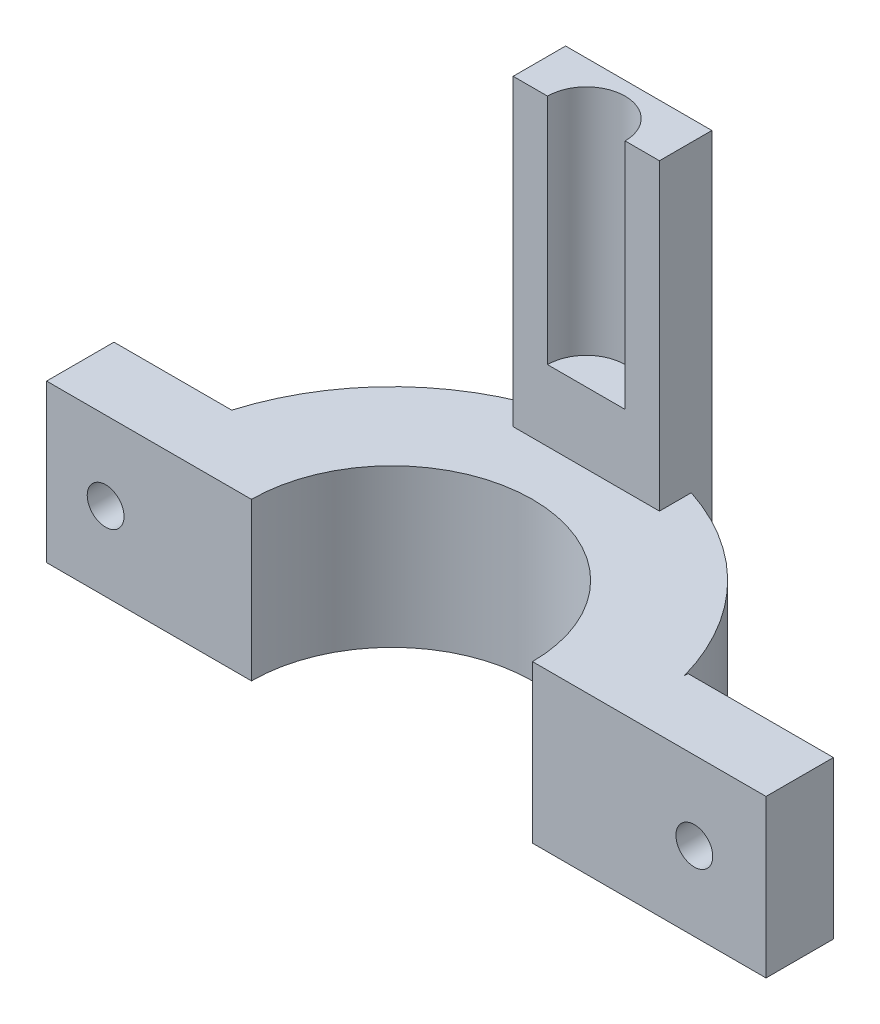
from build123d import *

# Parameters (mm, degrees)
SKETCH_1_W                = 48.51
SKETCH_1_H                = 34
SKETCH_1_W_2              = 28.51
SKETCH_1_H_2              = 14
EXTRUDE_1_DEPTH           = 12.25
SKETCH_2_R                = 1.91
CUT_EXTRUDE_1_DEPTH       = 33.05257439
SKETCH_4_W                = 13
SKETCH_4_H                = 13.91
EXTRUDE_1_2_DEPTH         = 74.82
SKETCH_5_W                = 13.91
SKETCH_5_H                = 16.23
EXTRUDE_2_DEPTH           = 15
SKETCH_7_R                = 24.5
SKETCH_7_R_2              = 14.5
EXTRUDE_2_2_DEPTH         = 16.23
SKETCH_12_R               = 1.9
CUT_EXTRUDE_4_DEPTH       = 97.312124675
EXTRUDE_3_DEPTH           = 10
EXTRUDE_3_DEPTH_BACK      = 8
SKETCH_13_W               = 13.91
SKETCH_13_H               = 16.23
SKETCH_14_R               = 1.9
CUT_EXTRUDE_5_DEPTH       = 103.744583434
SKETCH_16_W               = 90.709398763
SKETCH_16_H               = 28.955068616
CUT_EXTRUDE_7_DEPTH       = 111.229011154
SKETCH_18_W               = 13
SKETCH_18_H               = 93.080932143
CUT_EXTRUDE_10_DEPTH      = 27
CUT_EXTRUDE_11_DEPTH      = 57
CUT_EXTRUDE_11_DEPTH_BACK = 27
SKETCH_17_W               = 20.23049449
SKETCH_17_H               = 80.723570055
SKETCH_21_W               = 15.09856282
SKETCH_21_H               = 42.5
EXTRUDE_6_DEPTH           = 10
SKETCH_22_R               = 4.005
CUT_EXTRUDE_12_DEPTH      = 24
SKETCH_23_W               = 15.09856282
SKETCH_23_H               = 4.587452919
CUT_EXTRUDE_13_DEPTH      = 85.439664289


with BuildPart() as part:
    # 草圖1 → Extrude 1 (new body)
    with BuildSketch(Plane(origin=(0, 0, 0), x_dir=(1, 0, 0), z_dir=(0, 1, 0))):
        Rectangle(SKETCH_1_W, SKETCH_1_H)
        Rectangle(SKETCH_1_W_2, SKETCH_1_H_2, mode=Mode.SUBTRACT)
    extrude(amount=EXTRUDE_1_DEPTH)

    # 草圖2 → 除料-伸長1 (cut, through all)
    with BuildSketch(Plane(origin=(0, 12.25, 0), x_dir=(1, 0, 0), z_dir=(0, 1, 0))):
        with Locations(Location((-19.255, 0, 0), (0, 0, 270))):
            Circle(SKETCH_2_R)
        with Locations(Location((19.255, 0, 0), (0, 0, 270))):
            Circle(SKETCH_2_R)
    extrude(amount=-CUT_EXTRUDE_1_DEPTH, mode=Mode.SUBTRACT)

    # 草圖4 → Extrude 1 2 (add)
    with BuildSketch(Plane.XZ):
        with Locations((17.755, 0)):
            Rectangle(SKETCH_4_W, SKETCH_4_H)
    extrude(amount=EXTRUDE_1_2_DEPTH)

    # 草圖5 → Extrude 2 (add)
    with BuildSketch(Plane.ZY.offset(-11.255)):
        with Locations((0, -66.705)):
            Rectangle(SKETCH_5_W, SKETCH_5_H)
    extrude(amount=EXTRUDE_2_DEPTH)

    # 草圖7 → Extrude 2 2 (add)
    with BuildSketch(Plane(origin=(3.626674765, -74.82, 0), x_dir=(1, 0, 0), z_dir=(0, -1, 0))):
        with Locations((-30.978154344, 0)):
            Circle(SKETCH_7_R)
        with Locations((-30.978154344, 0)):
            Circle(SKETCH_7_R_2, mode=Mode.SUBTRACT)
    extrude(amount=-EXTRUDE_2_2_DEPTH)

    # 草圖12 → 除料-伸長4 (cut, through all)
    with BuildSketch(Plane(origin=(0, 0, -6.955), x_dir=(-1, 0, 0), z_dir=(0, 0, -1))):
        with Locations((-3.856713649, -66.705)):
            Circle(SKETCH_12_R)
    extrude(amount=-CUT_EXTRUDE_4_DEPTH, mode=Mode.SUBTRACT)

    # 草圖13 → 填料-伸長3 (add, two sides: drawn at the far end of the back side and taken through both)
    with BuildSketch(Plane(origin=(-55, 0, 0), x_dir=(0, 0, -1), z_dir=(1, 0, 0)).offset(-EXTRUDE_3_DEPTH_BACK)):
        with Locations((0, -66.705)):
            Rectangle(SKETCH_13_W, SKETCH_13_H)
    extrude(amount=EXTRUDE_3_DEPTH + EXTRUDE_3_DEPTH_BACK)

    # 草圖14 → 除料-伸長5 (cut, through all)
    with BuildSketch(Plane(origin=(0, 0, -6.955), x_dir=(-1, 0, 0), z_dir=(0, 0, -1))):
        with Locations((56.908040017, -66.705)):
            Circle(SKETCH_14_R)
    extrude(amount=-CUT_EXTRUDE_5_DEPTH, mode=Mode.SUBTRACT)

    # 草圖16 → 除料-伸長7 (cut, through all)
    with BuildSketch(Plane(origin=(0, 12.25, 0), x_dir=(1, 0, 0), z_dir=(0, 1, 0))):
        with Locations((-17.645300619, -14.477534308)):
            Rectangle(SKETCH_16_W, SKETCH_16_H)
    extrude(amount=-CUT_EXTRUDE_7_DEPTH, mode=Mode.SUBTRACT)

    # 草圖18 → 除料-伸長10 (cut)
    with BuildSketch(Plane.XY):
        with Locations((17.755, -28.279533929)):
            Rectangle(SKETCH_18_W, SKETCH_18_H)
    extrude(amount=-CUT_EXTRUDE_10_DEPTH, mode=Mode.SUBTRACT)


with BuildPart() as cut_extrude_10_piece_1:
    # of the separate pieces the step leaves, piece 1, a body of its own (cut_extrude_10_pieces)
    add(part.part.solids().sort_by_distance((11.255, -58.59, -6.955))[0])

    # 草圖21 → 填料-伸長6 (add)
    with BuildSketch(Plane.XY.offset(-30)):
        with Locations((-27.29428141, -48.519427919)):
            Rectangle(SKETCH_21_W, SKETCH_21_H)
    extrude(amount=EXTRUDE_6_DEPTH)

    # 草圖22 → 除料-伸長12 (cut)
    with BuildSketch(Plane(origin=(0, -27.269427919, 0), x_dir=(1, 0, 0), z_dir=(0, 1, 0))):
        with Locations((-27.29428141, 20)):
            Circle(SKETCH_22_R)
    extrude(amount=-CUT_EXTRUDE_12_DEPTH, mode=Mode.SUBTRACT)

    # 草圖23 → 除料-伸長13 (cut, through all)
    with BuildSketch(Plane(origin=(0, -27.269427919, 0), x_dir=(1, 0, 0), z_dir=(0, 1, 0))):
        with Locations((-27.29428141, 27.706273541)):
            Rectangle(SKETCH_23_W, SKETCH_23_H)
    extrude(amount=-CUT_EXTRUDE_13_DEPTH, mode=Mode.SUBTRACT)


with BuildPart() as cut_extrude_10_piece_2:
    # of the separate pieces the step leaves, piece 2, a body of its own (cut_extrude_10_pieces)
    add(part.part.solids().sort_by_distance((-17.345, 0, 0))[0])

    # 草圖17 → 除料-伸長11 (cut, two sides: drawn at the far end of the back side and taken through both)
    with BuildSketch(Plane.ZY.offset(-11.255).offset(-CUT_EXTRUDE_11_DEPTH_BACK)):
        with Locations((-10.115247245, -18.228214973)):
            Rectangle(SKETCH_17_W, SKETCH_17_H)
    extrude(amount=CUT_EXTRUDE_11_DEPTH + CUT_EXTRUDE_11_DEPTH_BACK, mode=Mode.SUBTRACT)


solid = cut_extrude_10_piece_1.part
